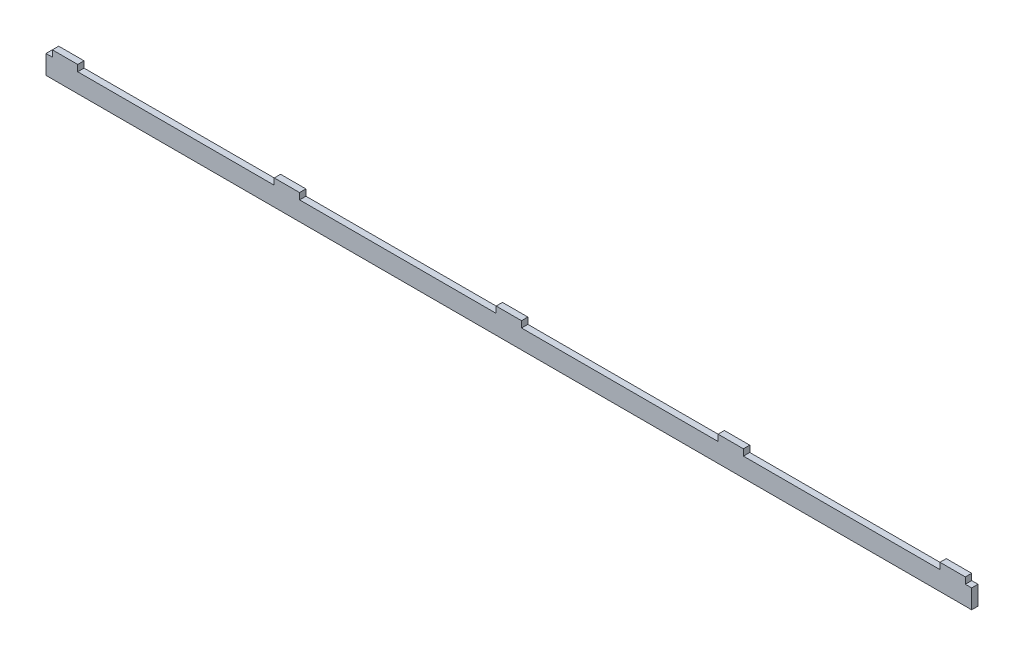
from build123d import *

# Parameters (mm, degrees)
BOSS_EXTRUDE1_DEPTH = 0.79375


with BuildPart() as part:
    # Sketch1 → Boss-Extrude1 (new, symmetric)
    with BuildSketch(Plane.XY):
        Polygon((-115.8875, 0), (115.8875, 0), (115.8875, 4.7625), (114.3, 4.7625), (114.3, 6.35), (107.95, 6.35), (107.95, 4.7625), (58.7375, 4.7625), (58.7375, 6.35), (52.3875, 6.35), (52.3875, 4.7625), (3.175, 4.7625), (3.175, 6.35), (-3.175, 6.35), (-3.175, 4.7625), (-52.3875, 4.7625), (-52.3875, 6.35), (-58.7375, 6.35), (-58.7375, 4.7625), (-107.95, 4.7625), (-107.95, 6.35), (-114.3, 6.35), (-114.3, 4.7625), (-115.8875, 4.7625), align=None)
    extrude(amount=BOSS_EXTRUDE1_DEPTH, both=True)


solid = part.part
